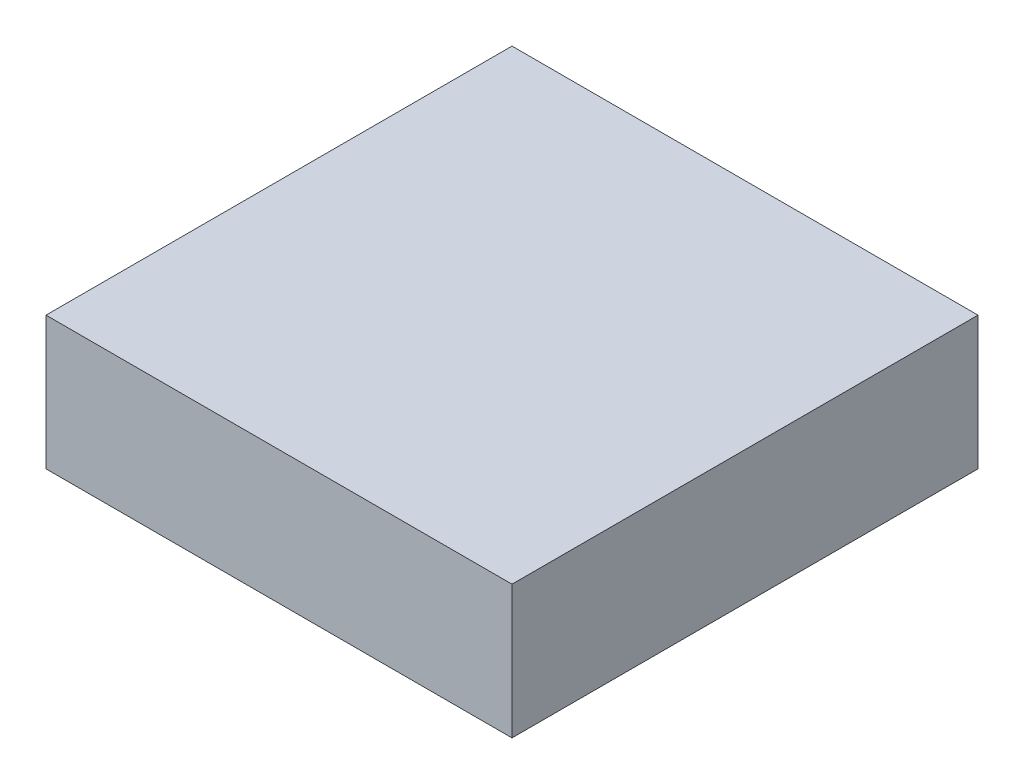
from build123d import *

# Parameters (mm, degrees)
SKETCH1_W           = 70
SKETCH1_H           = 70
BOSS_EXTRUDE1_DEPTH = 20
SKETCH2_W           = 65
SKETCH2_H           = 65
CUT_EXTRUDE1_DEPTH  = 15


with BuildPart() as part:
    # Sketch1 → Boss-Extrude1 (new body)
    with BuildSketch(Plane(origin=(0, 0, 0), x_dir=(1, 0, 0), z_dir=(0, 1, 0))):
        Rectangle(SKETCH1_W, SKETCH1_H)
    extrude(amount=BOSS_EXTRUDE1_DEPTH)

    # Sketch2 → Cut-Extrude1 (cut)
    with BuildSketch(Plane.XZ):
        Rectangle(SKETCH2_W, SKETCH2_H)
    extrude(amount=-CUT_EXTRUDE1_DEPTH, mode=Mode.SUBTRACT)


solid = part.part
